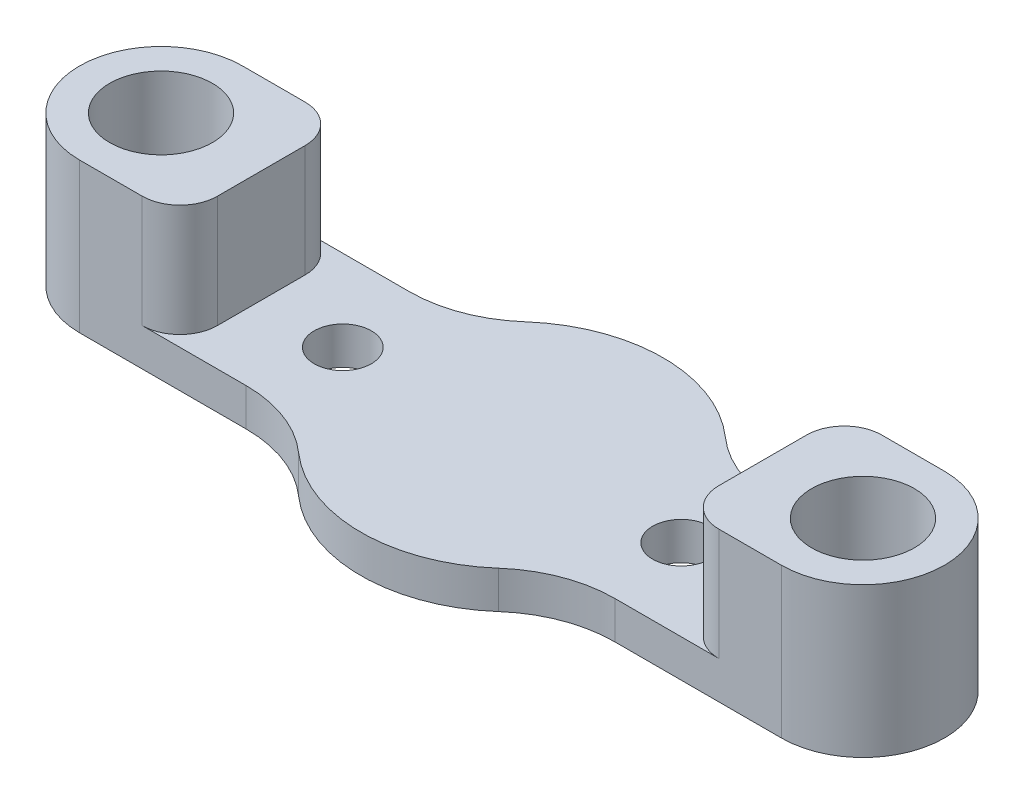
from build123d import *

# Parameters (mm, degrees)
SKETCH1_R           = 1.14
SKETCH1_R_2         = 2.05
BOSS_EXTRUDE2_DEPTH = 1.5
SKETCH2_R           = 2.05
BOSS_EXTRUDE3_DEPTH = 4.47
FILLET1_R           = 1.5


with BuildPart() as part:
    # Sketch1 → Boss-Extrude2 (new body)
    with BuildSketch(Plane(origin=(0, 0, 0), x_dir=(1, 0, 0), z_dir=(0, 1, 0))):
        with BuildLine():
            Line((-7.351408028, 3.25), (-14, 3.25))
            ThreePointArc((-14, 3.25), (-17.25, 0), (-14, -3.25))
            Line((-14, -3.25), (-7.351408028, -3.25))
            ThreePointArc((-7.351408028, -3.25), (-5.554548682, -3.578400639), (-3.990008138, -4.521143114))
            ThreePointArc((-3.990008138, -4.521143114), (0, -6.03), (3.990008138, -4.521143114))
            ThreePointArc((3.990008138, -4.521143114), (5.554548682, -3.578400639), (7.351408028, -3.25))
            Line((7.351408028, -3.25), (14, -3.25))
            ThreePointArc((14, -3.25), (17.25, 0), (14, 3.25))
            Line((14, 3.25), (7.351408028, 3.25))
            ThreePointArc((7.351408028, 3.25), (5.554548682, 3.578400639), (3.990008138, 4.521143114))
            ThreePointArc((3.990008138, 4.521143114), (0, 6.03), (-3.990008138, 4.521143114))
            ThreePointArc((-3.990008138, 4.521143114), (-5.554548682, 3.578400639), (-7.351408028, 3.25))
        make_face()
        with Locations(Location((-6.75, 0, 0), (0, 0, 270))):
            Circle(SKETCH1_R, mode=Mode.SUBTRACT)
        with Locations(Location((-14, 0, 0), (0, 0, 270))):
            Circle(SKETCH1_R_2, mode=Mode.SUBTRACT)
        with Locations(Location((6.75, 0, 0), (0, 0, 90))):
            Circle(SKETCH1_R, mode=Mode.SUBTRACT)
        with Locations(Location((14, 0, 0), (0, 0, 90))):
            Circle(SKETCH1_R_2, mode=Mode.SUBTRACT)
    extrude(amount=BOSS_EXTRUDE2_DEPTH)

    # Sketch2 → Boss-Extrude3 (add)
    # profile 1 of 2: a face of its own
    with BuildSketch(Plane(origin=(0, 1.5, 0), x_dir=(1, 0, 0), z_dir=(0, 1, 0))):
        with BuildLine():
            Line((-14, 3.25), (-10, 3.25))
            Line((-10, 3.25), (-10, -3.25))
            Line((-10, -3.25), (-14, -3.25))
            ThreePointArc((-14, -3.25), (-17.25, 0), (-14, 3.25))
        make_face()
        with Locations(Location((-14, 0, 0), (0, 0, 270))):
            Circle(SKETCH2_R, mode=Mode.SUBTRACT)
    # profile 2 of 2: a face of its own
    with BuildSketch(Plane(origin=(0, 1.5, 0), x_dir=(1, 0, 0), z_dir=(0, 1, 0))):
        with BuildLine():
            Line((10, -3.25), (14, -3.25))
            ThreePointArc((14, -3.25), (17.25, 0), (14, 3.25))
            Line((14, 3.25), (10, 3.25))
            Line((10, 3.25), (10, -3.25))
        make_face()
        with Locations(Location((14, 0, 0), (0, 0, 90))):
            Circle(SKETCH2_R, mode=Mode.SUBTRACT)
    extrude(amount=BOSS_EXTRUDE3_DEPTH)

    # Fillet1
    fillet1_edges = [part.edges().sort_by_distance(p)[0] for p in [
        (-10, 3.735, 3.25),
        (-10, 3.735, -3.25),
        (10, 3.735, -3.25),
        (10, 3.735, 3.25),
    ]]
    fillet(fillet1_edges, radius=FILLET1_R)


solid = part.part
